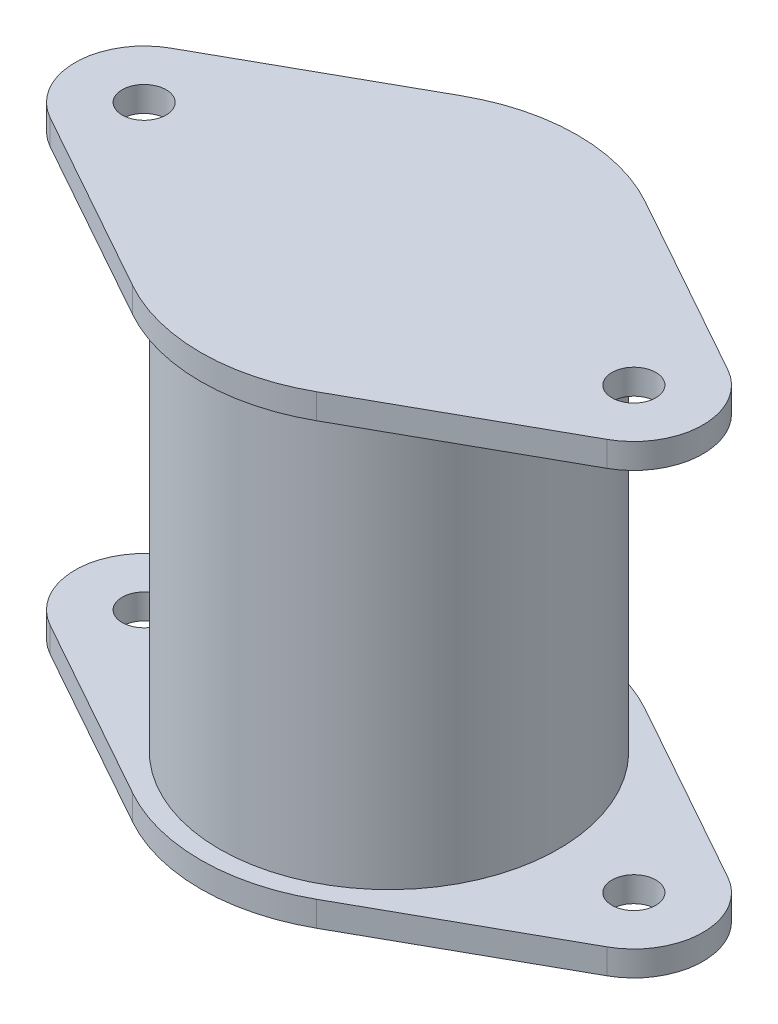
from build123d import *

# Parameters (mm, degrees)
SKETCH_1_R      = 1.75
EXTRUDE_1_DEPTH = 2
SKETCH_1_3_R    = 13.5
EXTRUDE_2_DEPTH = 16.5


with BuildPart() as part:
    # 草图1 → 凸台-拉伸1 (new body)
    with BuildSketch(Plane(origin=(0, 0, 0), x_dir=(1, 0, 0), z_dir=(0, 1, 0))):
        with BuildLine():
            Line((-7.307692308, 13.099527974), (-22.179487179, 4.803160257))
            ThreePointArc((-22.179487179, 4.803160257), (-25, 0), (-22.179487179, -4.803160257))
            Line((-22.179487179, -4.803160257), (-7.307692308, -13.099527974))
            ThreePointArc((-7.307692308, -13.099527974), (0, -15), (7.307692308, -13.099527974))
            Line((7.307692308, -13.099527974), (22.179487179, -4.803160257))
            ThreePointArc((22.179487179, -4.803160257), (25, 0), (22.179487179, 4.803160257))
            Line((22.179487179, 4.803160257), (7.307692308, 13.099527974))
            ThreePointArc((7.307692308, 13.099527974), (0, 15), (-7.307692308, 13.099527974))
        make_face()
        with Locations((-19.5, 0)):
            Circle(SKETCH_1_R, mode=Mode.SUBTRACT)
        with Locations((19.5, 0)):
            Circle(SKETCH_1_R, mode=Mode.SUBTRACT)
    extrude(amount=-EXTRUDE_1_DEPTH)

    # 草图1<3> → 凸台-拉伸2 (add)
    with BuildSketch(Plane(origin=(0, 0, 0), x_dir=(1, 0, 0), z_dir=(0, 1, 0))):
        Circle(SKETCH_1_3_R)
    extrude(amount=EXTRUDE_2_DEPTH)

    # 镜向3: part across plane


with BuildPart() as part_1:
    add(part.part)
    add(part.part.mirror(Plane.ZX.offset(16.5)))


solid = part_1.part
